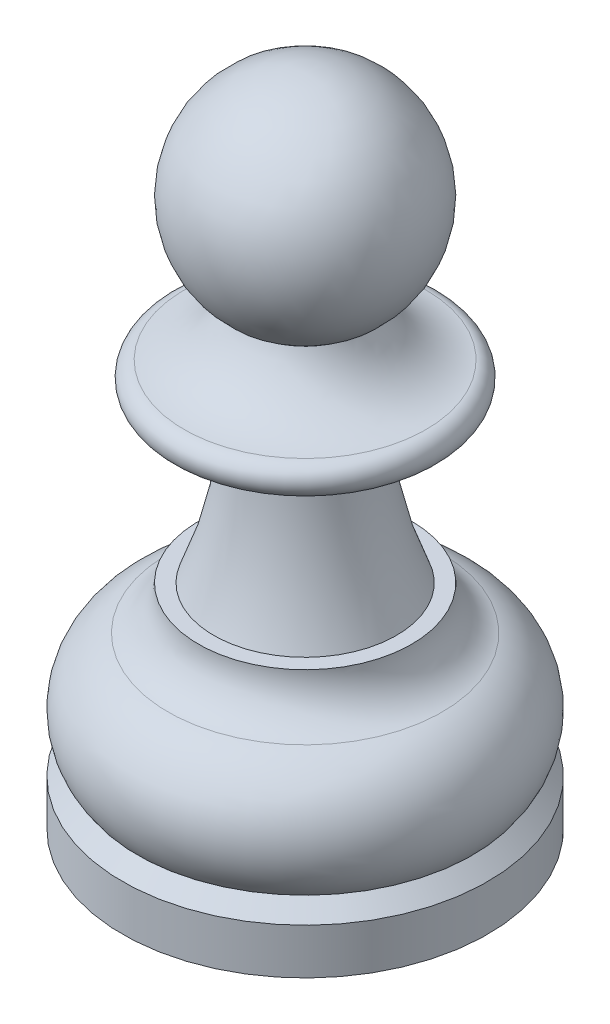
from build123d import *


with BuildPart() as part:
    # Sketch1 → Revolve1 (revolve)
    with BuildSketch(Plane(origin=(0, 0, 0), x_dir=(0, 0, -1), z_dir=(1, 0, 0))):
        with BuildLine():
            Line((0, 0), (0, 43))
            ThreePointArc((0, 43), (6.745368782, 37.870828693), (3.605551275, 30))
            ThreePointArc((3.605551275, 30), (5.320030077, 27.746998352), (7.94372856, 26.683203135))
            ThreePointArc((7.94372856, 26.683203135), (8.825947362, 25.718554332), (8, 24.705307923))
            Line((8, 24.705307923), (4, 24))
            ThreePointArc((4, 24), (4.504902432, 18.900980486), (6, 14))
            Line((6, 14), (7, 14))
            ThreePointArc((7, 14), (7.549619925, 12.255305385), (9, 11.140657908))
            ThreePointArc((9, 11.140657908), (11.830797515, 8.08311014), (11, 4))
            Line((11, 4), (12, 3))
            Line((12, 3), (12, 0))
            Line((12, 0), (0, 0))
        make_face()
    revolve(axis=Axis((0, 0, 0), (0, 1, 0)))


solid = part.part
